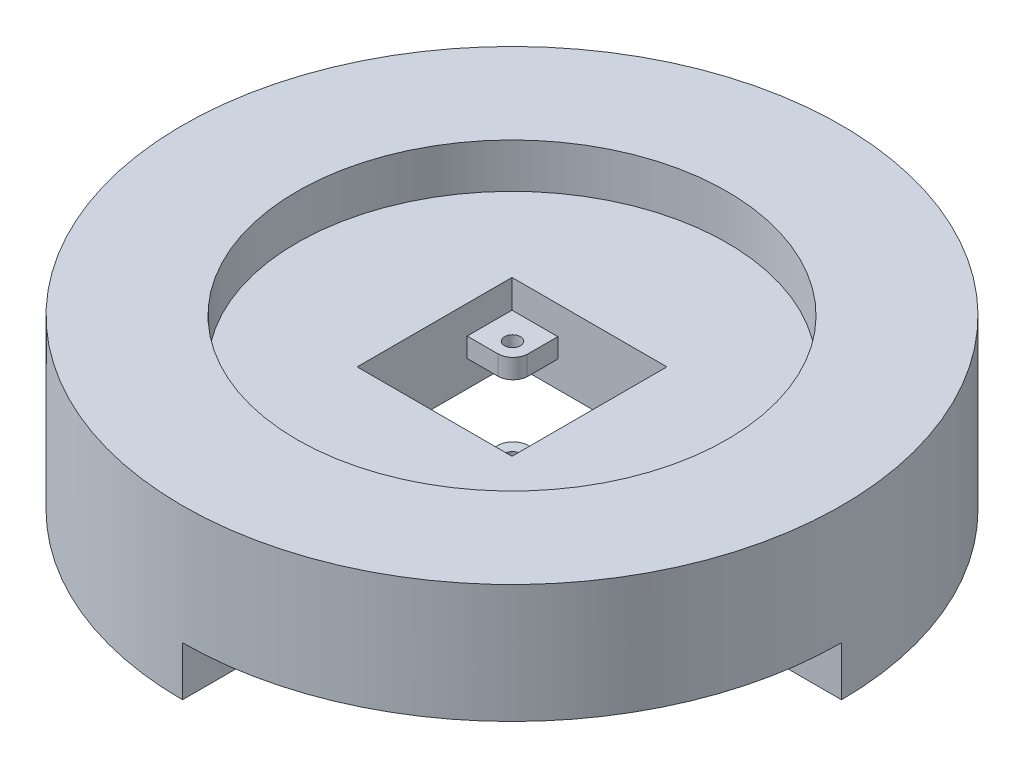
from build123d import *

# Parameters (mm, degrees)
SKETCH1_R           = 50
BOSS_EXTRUDE1_DEPTH = 25
SKETCH2_R           = 32.625
CUT_EXTRUDE1_DEPTH  = 6.75
SKETCH3_W           = 23.5
SKETCH3_H           = 23.5
CUT_EXTRUDE2_DEPTH  = 4.3
CUT_EXTRUDE3_DEPTH  = 13.95
SKETCH24_W          = 23.5
SKETCH24_H          = 23.5
CUT_EXTRUDE4_DEPTH  = 11
SKETCH25_R          = 50
CUT_EXTRUDE5_DEPTH  = 7
SKETCH26_R          = 1.2
CUT_EXTRUDE6_DEPTH  = 72.568865437
BOSS_EXTRUDE2_START = 7.5
BOSS_EXTRUDE2_DEPTH = 7.5


with BuildPart() as part:
    # Sketch1 → Boss-Extrude1 (new body)
    with BuildSketch(Plane(origin=(0, 0, 0), x_dir=(1, 0, 0), z_dir=(0, 1, 0))):
        with Locations(Location((0, 0, 0), (0, 0, 270))):
            Circle(SKETCH1_R)
    extrude(amount=BOSS_EXTRUDE1_DEPTH)

    # Sketch2 → Cut-Extrude1 (cut)
    with BuildSketch(Plane(origin=(0, 25, 0), x_dir=(1, 0, 0), z_dir=(0, 1, 0))):
        with Locations(Location((0, 0, 0), (0, 0, 270))):
            Circle(SKETCH2_R)
    extrude(amount=-CUT_EXTRUDE1_DEPTH, mode=Mode.SUBTRACT)

    # Sketch3 → Cut-Extrude2 (cut)
    with BuildSketch(Plane(origin=(0, 18.25, 0), x_dir=(1, 0, 0), z_dir=(0, 1, 0))):
        Rectangle(SKETCH3_W, SKETCH3_H)
    extrude(amount=-CUT_EXTRUDE2_DEPTH, mode=Mode.SUBTRACT)

    # Sketch4 → Cut-Extrude3 (cut)
    with BuildSketch(Plane(origin=(0, 13.95, 0), x_dir=(1, 0, 0), z_dir=(0, 1, 0))):
        with BuildLine():
            Line((-11.75, 4.95), (-7.1, 4.95))
            ThreePointArc((-7.1, 4.95), (-5.525793851, 5.571198073), (-4.8, 7.1))
            Line((-4.8, 7.1), (-4.8, 11.75))
            Line((-4.8, 11.75), (11.75, 11.75))
            Line((11.75, 11.75), (11.75, -4.8))
            Line((11.75, -4.8), (7.1, -4.8))
            ThreePointArc((7.1, -4.8), (5.571198073, -5.525793851), (4.95, -7.1))
            Line((4.95, -7.1), (4.95, -11.75))
            Line((4.95, -11.75), (-11.75, -11.75))
            Line((-11.75, -11.75), (-11.75, 4.95))
        make_face()
    extrude(amount=-CUT_EXTRUDE3_DEPTH, mode=Mode.SUBTRACT)

    # Sketch24 → Cut-Extrude4 (cut)
    with BuildSketch(Plane.XZ):
        Rectangle(SKETCH24_W, SKETCH24_H)
    extrude(amount=-CUT_EXTRUDE4_DEPTH, mode=Mode.SUBTRACT)

    # Sketch25 → Cut-Extrude5 (cut)
    with BuildSketch(Plane.XZ):
        with Locations(Location((0, 0, 0), (0, 0, 270))):
            Circle(SKETCH25_R)
    extrude(amount=-CUT_EXTRUDE5_DEPTH, mode=Mode.SUBTRACT)

    # Sketch26 → Cut-Extrude6 (cut, through all)
    with BuildSketch(Plane(origin=(0, 13.95, 0), x_dir=(1, 0, 0), z_dir=(0, 1, 0))):
        with Locations(Location((-7.638603897, 7.713603897, 0), (0, 0, 270))):
            Circle(SKETCH26_R)
        with Locations(Location((7.713603897, -7.638603897, 0), (0, 0, 270))):
            Circle(SKETCH26_R)
    extrude(amount=-CUT_EXTRUDE6_DEPTH, mode=Mode.SUBTRACT)

    # Sketch27 → Boss-Extrude2 (add)
    with BuildSketch(Plane.XZ.offset(-7).offset(BOSS_EXTRUDE2_START)):
        with BuildLine():
            Line((-50, 0), (-40, 0))
            ThreePointArc((-40, 0), (-28.284271247, 28.284271247), (0, 40))
            Line((0, 40), (0, 50))
            ThreePointArc((0, 50), (-35.355339059, 35.355339059), (-50, 0))
        make_face()
        with BuildLine():
            Line((40, 0), (50, 0))
            ThreePointArc((50, 0), (35.355339059, -35.355339059), (0, -50))
            Line((0, -50), (0, -40))
            ThreePointArc((0, -40), (28.284271247, -28.284271247), (40, 0))
        make_face()
    extrude(amount=-BOSS_EXTRUDE2_DEPTH)


solid = part.part
